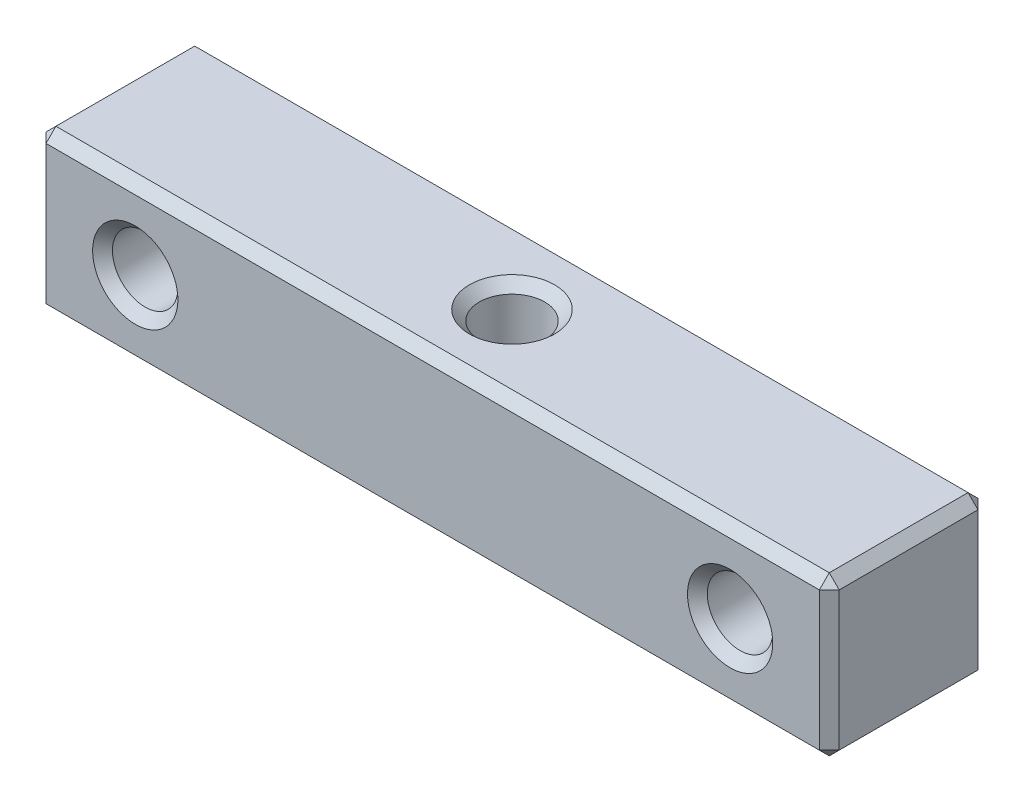
from build123d import *

# Parameters (mm, degrees)
SKETCH_1_W             = 40
SKETCH_1_H             = 8
EXTRUDE_1_DEPTH        = 4
HOLE_WIZARD_M4_1_D     = 3.3
HOLE_WIZARD_M4_1_DEPTH = 10.1
HOLE_WIZARD_M4_1_TIP   = 0.991420021
HOLE_WIZARD_M4_2_D     = 3.3
HOLE_WIZARD_M4_2_DEPTH = 10.1
HOLE_WIZARD_M4_2_TIP   = 0.991420021
CHAMFER_1_SIZE         = 0.5


with BuildPart() as part:
    # 草图1 → 凸台-拉伸1 (new, symmetric)
    with BuildSketch(Plane.XY):
        Rectangle(SKETCH_1_W, SKETCH_1_H)
    extrude(amount=EXTRUDE_1_DEPTH, both=True)

    # M4 螺纹孔1
    with Locations(Plane.XY.offset(4)):
        with Locations((-15, 0), (15, 0)):
            Hole(HOLE_WIZARD_M4_1_D / 2, depth=HOLE_WIZARD_M4_1_DEPTH)
            with Locations((0, 0, -(HOLE_WIZARD_M4_1_DEPTH + HOLE_WIZARD_M4_1_TIP / 2))):  # 118° drill point
                Cone(0, HOLE_WIZARD_M4_1_D / 2, HOLE_WIZARD_M4_1_TIP, mode=Mode.SUBTRACT)

    # M4 螺纹孔2
    with Locations(Plane(origin=(0, 4, 0), x_dir=(1, 0, 0), z_dir=(0, 1, 0))):
        with Locations((0, 0)):
            Hole(HOLE_WIZARD_M4_2_D / 2, depth=HOLE_WIZARD_M4_2_DEPTH)
            with Locations((0, 0, -(HOLE_WIZARD_M4_2_DEPTH + HOLE_WIZARD_M4_2_TIP / 2))):  # 118° drill point
                Cone(0, HOLE_WIZARD_M4_2_D / 2, HOLE_WIZARD_M4_2_TIP, mode=Mode.SUBTRACT)

    # 倒角1
    chamfer_1_edges = [part.edges().sort_by_distance(p)[0] for p in [
        (-20, 0, 4),
        (16.65, 0, -4),
        (16.65, 0, 4),
        (0, -4, 4),
        (-13.35, 0, -4),
        (-13.35, 0, 4),
        (1.65, -4, 0),
        (1.65, 4, 0),
        (20, 0, 4),
        (0, -4, -4),
        (-20, 0, -4),
        (0, 4, -4),
        (20, 0, -4),
        (20, -4, 0),
        (-20, -4, 0),
        (-20, 4, 0),
        (20, 4, 0),
        (0, 4, 4),
    ]]
    chamfer(chamfer_1_edges, length=CHAMFER_1_SIZE)


solid = part.part
